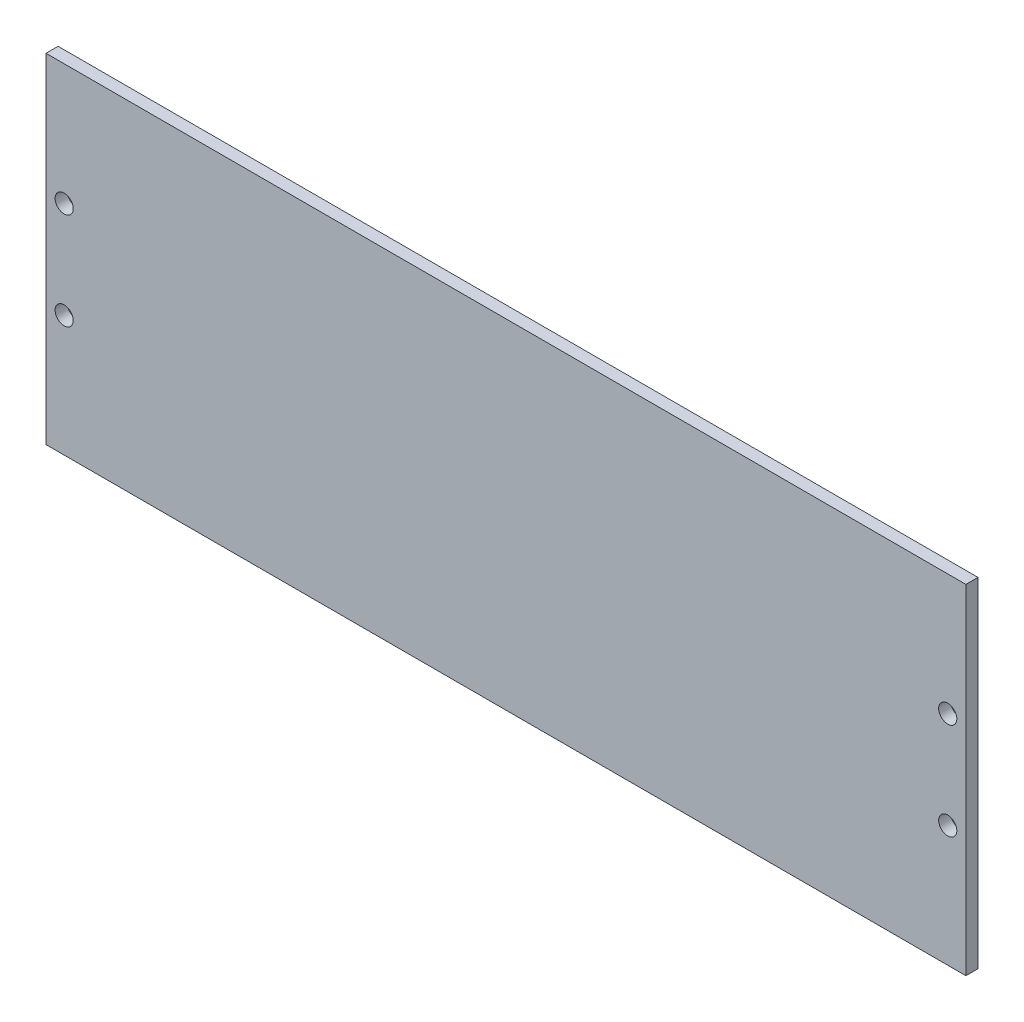
from build123d import *

# Parameters (mm, degrees)
ESQUISSE1_W        = 152
ESQUISSE1_H        = 56
ESQUISSE1_R        = 1.5
BOSS_EXTRU_1_DEPTH = 2


with BuildPart() as part:
    # Esquisse1 → Boss.-Extru.1 (new body)
    with BuildSketch(Plane.XY):
        with Locations((76, 28)):
            Rectangle(ESQUISSE1_W, ESQUISSE1_H)
        with Locations((3, 36)):
            Circle(ESQUISSE1_R, mode=Mode.SUBTRACT)
        with Locations((3, 20)):
            Circle(ESQUISSE1_R, mode=Mode.SUBTRACT)
        with Locations((149, 20)):
            Circle(ESQUISSE1_R, mode=Mode.SUBTRACT)
        with Locations((149, 36)):
            Circle(ESQUISSE1_R, mode=Mode.SUBTRACT)
    extrude(amount=BOSS_EXTRU_1_DEPTH)


solid = part.part
